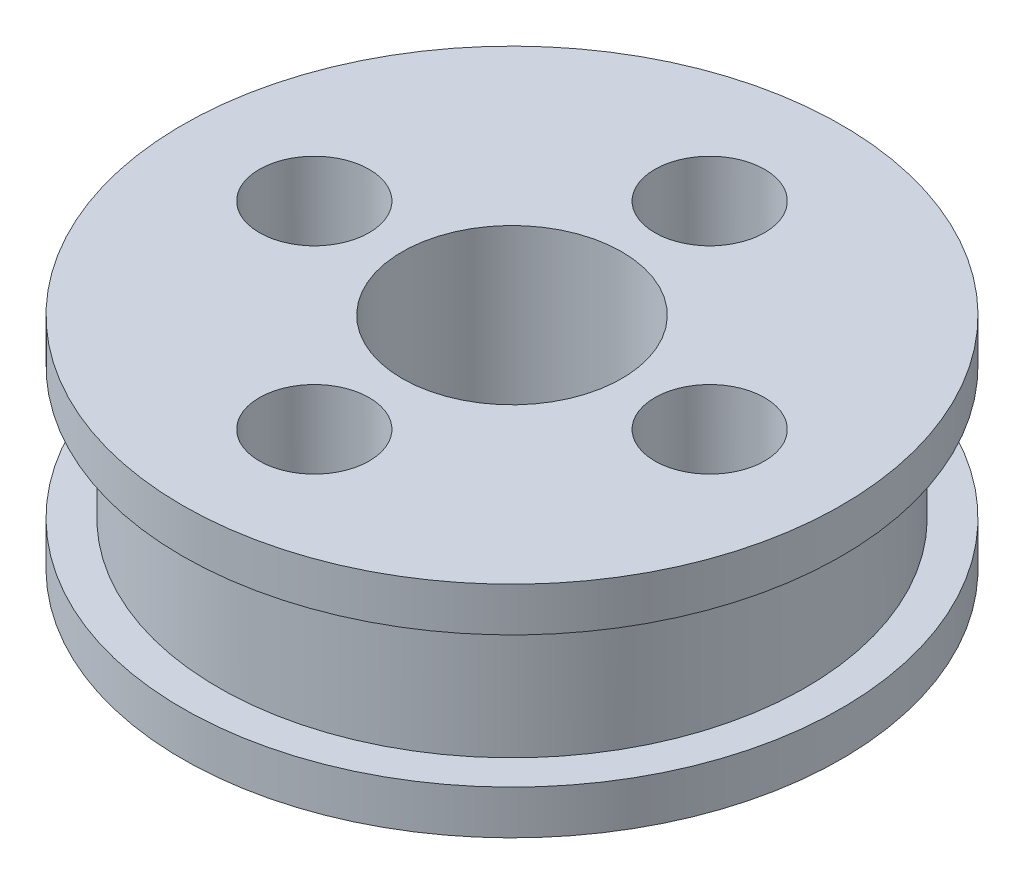
from build123d import *

# Parameters (mm, degrees)
SKETCH1_R               = 13.365
BOSS_EXTRUDE1_DEPTH     = 10
SKETCH2_R               = 15
BOSS_EXTRUDE2_DEPTH     = 2
BOSS_EXTRUDE3_START     = -2
SKETCH3_R               = 15
BOSS_EXTRUDE3_DEPTH     = 2
CUT_EXTRUDE1_DEPTH      = 10
CUT_EXTRUDE1_DEPTH_BACK = 24.452078799
SKETCH4_R               = 5
SKETCH4_R_2             = 2.5


with BuildPart() as part:
    # Sketch1 → Boss-Extrude1 (new body)
    with BuildSketch(Plane(origin=(0, 0, 0), x_dir=(1, 0, 0), z_dir=(0, 1, 0))):
        Circle(SKETCH1_R)
    extrude(amount=BOSS_EXTRUDE1_DEPTH)

    # Sketch2 → Boss-Extrude2 (add)
    with BuildSketch(Plane(origin=(0, 10, 0), x_dir=(1, 0, 0), z_dir=(0, 1, 0))):
        Circle(SKETCH2_R)
    extrude(amount=-BOSS_EXTRUDE2_DEPTH)

    # Sketch3 → Boss-Extrude3 (add)
    with BuildSketch(Plane.XZ.offset(BOSS_EXTRUDE3_START)):
        Circle(SKETCH3_R)
    extrude(amount=BOSS_EXTRUDE3_DEPTH)

    # Sketch4 → Cut-Extrude1 (cut, two sides: drawn at the far end of the back side and taken through both)
    with BuildSketch(Plane.XZ.offset(-CUT_EXTRUDE1_DEPTH_BACK)):
        Circle(SKETCH4_R)
        with Locations((9, 0)):
            Circle(SKETCH4_R_2)
        with Locations((0, 9)):
            Circle(SKETCH4_R_2)
        with Locations((0, -9)):
            Circle(SKETCH4_R_2)
        with Locations((-9, 0)):
            Circle(SKETCH4_R_2)
    extrude(amount=CUT_EXTRUDE1_DEPTH + CUT_EXTRUDE1_DEPTH_BACK, mode=Mode.SUBTRACT)


solid = part.part
